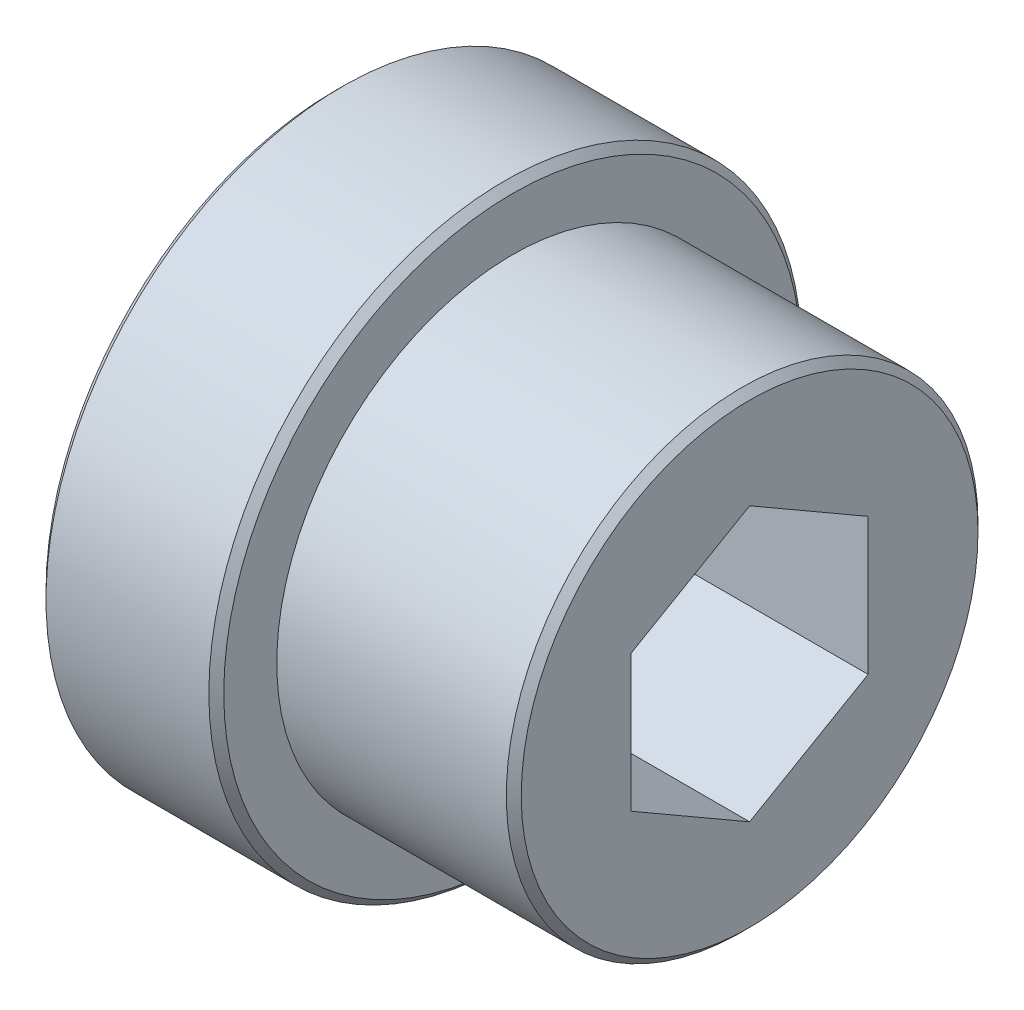
from build123d import *

# Parameters (mm, degrees)
SKETCH1_R           = 12.6365
BOSS_EXTRUDE1_DEPTH = 12.7
SKETCH2_R           = 15.875
BOSS_EXTRUDE2_DEPTH = 9.525
CHAMFER1_SIZE       = 0.4
CUT_EXTRUDE1_DEPTH  = 32.590851128


with BuildPart() as part:
    # Sketch1 → Boss-Extrude1 (new body)
    with BuildSketch(Plane(origin=(0, 0, 0), x_dir=(0, 0, -1), z_dir=(1, 0, 0))):
        Circle(SKETCH1_R)
    extrude(amount=BOSS_EXTRUDE1_DEPTH)

    # Sketch2 → Boss-Extrude2 (add)
    with BuildSketch(Plane.ZY):
        with Locations(Location((0, 0, 0), (0, 0, 180))):
            Circle(SKETCH2_R)
    extrude(amount=BOSS_EXTRUDE2_DEPTH)

    # Chamfer1
    chamfer1_edges = [part.edges().sort_by_distance(p)[0] for p in [
        (12.7, 0, 12.6365),
        (0, 0, 15.875),
        (-9.525, 0, 15.875),
    ]]
    chamfer(chamfer1_edges, length=CHAMFER1_SIZE)

    # Sketch4 → Cut-Extrude1 (cut, through all)
    with BuildSketch(Plane.ZY.offset(9.525)):
        Polygon((0, 7.332348419), (-6.35, 3.666174209), (-6.35, -3.666174209), (0, -7.332348419), (6.35, -3.666174209), (6.35, 3.666174209), align=None)
    extrude(amount=-CUT_EXTRUDE1_DEPTH, mode=Mode.SUBTRACT)


solid = part.part
